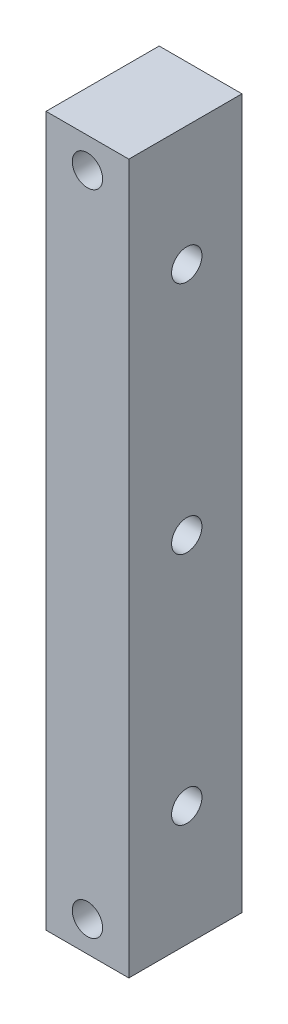
from build123d import *

# Parameters (mm, degrees)
BLOCK_OUTLINE_W                            = 6
BLOCK_OUTLINE_H                            = 51.4
REACTION_BLOCK_THICKNESS_DEPTH             = 8.2
LANE_1_INNER_CABLE_CLEARANCE_PROFILE_R     = 1.1
LANE_1_INNER_CABLE_CLEARANCE_DEPTH         = 6.2
LANE_1_COMPRESSION_HOUSING_SOCKET_PROFIL_R = 2.05
LANE_1_COMPRESSION_HOUSING_SOCKET_DEPTH    = 4.1
LANE_2_INNER_CABLE_CLEARANCE_PROFILE_R     = 1.1
LANE_2_INNER_CABLE_CLEARANCE_DEPTH         = 6.2
LANE_2_COMPRESSION_HOUSING_SOCKET_PROFIL_R = 2.05
LANE_2_COMPRESSION_HOUSING_SOCKET_DEPTH    = 4.1
LANE_3_INNER_CABLE_CLEARANCE_PROFILE_R     = 1.1
LANE_3_INNER_CABLE_CLEARANCE_DEPTH         = 6.2
LANE_3_COMPRESSION_HOUSING_SOCKET_PROFIL_R = 2.05
LANE_3_COMPRESSION_HOUSING_SOCKET_DEPTH    = 4.1
M2_FIXING_CLEARANCE_1_PROFILE_R            = 1.1
M2_FIXING_CLEARANCE_1_DEPTH                = 8.4
M2_FIXING_CLEARANCE_2_PROFILE_R            = 1.1
M2_FIXING_CLEARANCE_2_DEPTH                = 8.4


with BuildPart() as part:
    # Block outline → Reaction block thickness (new body)
    with BuildSketch(Plane.XY.offset(11)):
        with Locations((-63.291651246, -29)):
            Rectangle(BLOCK_OUTLINE_W, BLOCK_OUTLINE_H)
    extrude(amount=REACTION_BLOCK_THICKNESS_DEPTH)

    # Lane 1 inner cable clearance profile → Lane 1 inner cable clearance (cut)
    with BuildSketch(Plane(origin=(-66.391651246, 0, 0), x_dir=(0, 0, -1), z_dir=(1, 0, 0))):
        with Locations(Location((-15, -12, 0), (0, 0, 180))):
            Circle(LANE_1_INNER_CABLE_CLEARANCE_PROFILE_R)
    extrude(amount=LANE_1_INNER_CABLE_CLEARANCE_DEPTH, mode=Mode.SUBTRACT)

    # Lane 1 compression housing socket profil → Lane 1 compression housing socket (cut)
    with BuildSketch(Plane(origin=(-66.391651246, 0, 0), x_dir=(0, 0, -1), z_dir=(1, 0, 0))):
        with Locations((-15, -12)):
            Circle(LANE_1_COMPRESSION_HOUSING_SOCKET_PROFIL_R)
    extrude(amount=LANE_1_COMPRESSION_HOUSING_SOCKET_DEPTH, mode=Mode.SUBTRACT)

    # Lane 2 inner cable clearance profile → Lane 2 inner cable clearance (cut)
    with BuildSketch(Plane(origin=(-66.391651246, 0, 0), x_dir=(0, 0, -1), z_dir=(1, 0, 0))):
        with Locations(Location((-15, -29, 0), (0, 0, 180))):
            Circle(LANE_2_INNER_CABLE_CLEARANCE_PROFILE_R)
    extrude(amount=LANE_2_INNER_CABLE_CLEARANCE_DEPTH, mode=Mode.SUBTRACT)

    # Lane 2 compression housing socket profil → Lane 2 compression housing socket (cut)
    with BuildSketch(Plane(origin=(-66.391651246, 0, 0), x_dir=(0, 0, -1), z_dir=(1, 0, 0))):
        with Locations((-15, -29)):
            Circle(LANE_2_COMPRESSION_HOUSING_SOCKET_PROFIL_R)
    extrude(amount=LANE_2_COMPRESSION_HOUSING_SOCKET_DEPTH, mode=Mode.SUBTRACT)

    # Lane 3 inner cable clearance profile → Lane 3 inner cable clearance (cut)
    with BuildSketch(Plane(origin=(-66.391651246, 0, 0), x_dir=(0, 0, -1), z_dir=(1, 0, 0))):
        with Locations(Location((-15, -46, 0), (0, 0, 180))):
            Circle(LANE_3_INNER_CABLE_CLEARANCE_PROFILE_R)
    extrude(amount=LANE_3_INNER_CABLE_CLEARANCE_DEPTH, mode=Mode.SUBTRACT)

    # Lane 3 compression housing socket profil → Lane 3 compression housing socket (cut)
    with BuildSketch(Plane(origin=(-66.391651246, 0, 0), x_dir=(0, 0, -1), z_dir=(1, 0, 0))):
        with Locations((-15, -46)):
            Circle(LANE_3_COMPRESSION_HOUSING_SOCKET_PROFIL_R)
    extrude(amount=LANE_3_COMPRESSION_HOUSING_SOCKET_DEPTH, mode=Mode.SUBTRACT)

    # M2 fixing clearance 1 profile → M2 fixing clearance 1 (cut)
    with BuildSketch(Plane.XY.offset(10.9)):
        with Locations((-63.291651246, -5.5)):
            Circle(M2_FIXING_CLEARANCE_1_PROFILE_R)
    extrude(amount=M2_FIXING_CLEARANCE_1_DEPTH, mode=Mode.SUBTRACT)

    # M2 fixing clearance 2 profile → M2 fixing clearance 2 (cut)
    with BuildSketch(Plane.XY.offset(10.9)):
        with Locations((-63.291651246, -52.5)):
            Circle(M2_FIXING_CLEARANCE_2_PROFILE_R)
    extrude(amount=M2_FIXING_CLEARANCE_2_DEPTH, mode=Mode.SUBTRACT)


solid = part.part
